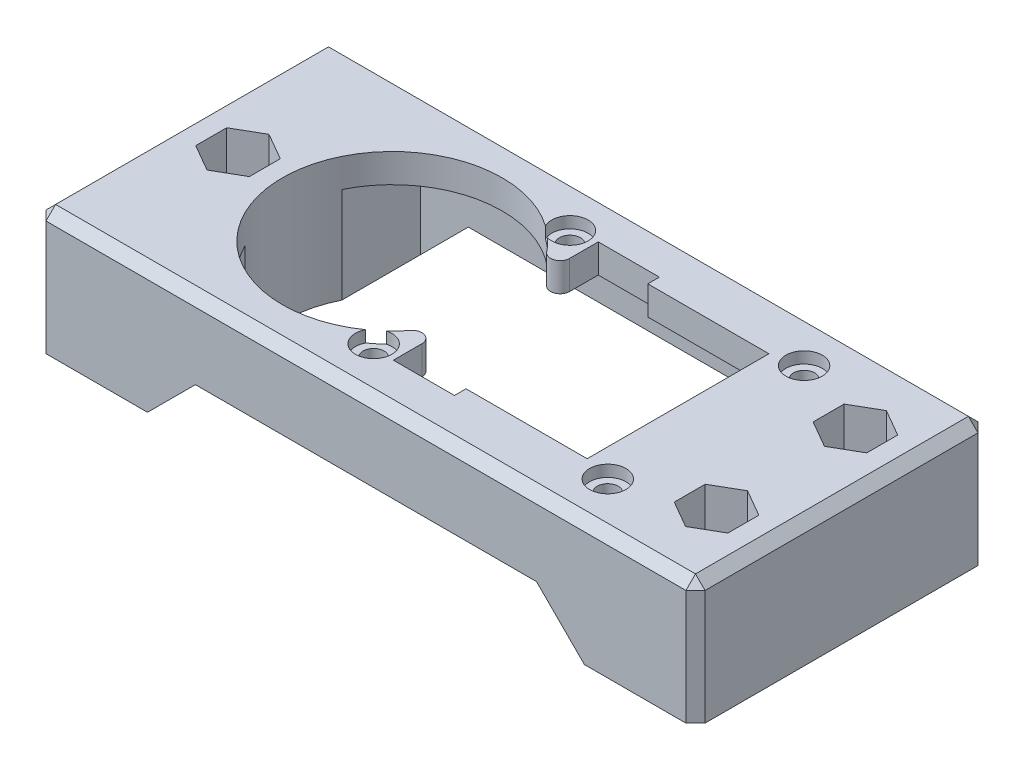
from build123d import *

# Parameters (mm, degrees)
ESQUISSE1_W                                        = 50.5
ESQUISSE1_H                                        = 26.5
ESQUISSE1_R                                        = 1.1
BOSS_EXTRU_1_DEPTH                                 = 3
CONG_1_R                                           = 1
CHAMBRAGE_POUR_VIS_SIX_PANS_CREUX_M1_6_D           = 2.2
CHAMBRAGE_POUR_VIS_SIX_PANS_CREUX_M1_6_CBORE_D     = 3.8
CHAMBRAGE_POUR_VIS_SIX_PANS_CREUX_M1_6_CBORE_DEPTH = 1.2
BOSS_EXTRU_2_START                                 = -19
ESQUISSE4_R                                        = 1.6
ESQUISSE4_W                                        = 11.6
ESQUISSE4_H                                        = 26.5
BOSS_EXTRU_2_DEPTH                                 = 19
ENL_V_START                                        = -19
ENL_V_MAT_EXTRU_1_DEPTH                            = 7
ESQUISSE6_W                                        = 11.6
ESQUISSE6_H                                        = 6
ENL_V_MAT_EXTRU_2_DEPTH                            = 50.487191272
BOSS_EXTRU_3_DEPTH                                 = 2
CHANFREIN1_SIZE                                    = 1


with BuildPart() as part:
    # Esquisse1 → Boss.-Extru.1 (new body)
    with BuildSketch(Plane(origin=(0, 0, 0), x_dir=(1, 0, 0), z_dir=(0, 1, 0))):
        with Locations((4.2, 10.25)):
            Rectangle(ESQUISSE1_W, ESQUISSE1_H)
        with Locations(Location((0, 0, 0), (0, 0, 270))):
            Circle(ESQUISSE1_R, mode=Mode.SUBTRACT)
        with Locations(Location((24.45, 0, 0), (0, 0, 270))):
            Circle(ESQUISSE1_R, mode=Mode.SUBTRACT)
        with BuildLine():
            Line((8.89, 20.95), (8.89, 19.74))
            Line((8.89, 19.74), (21.54, 19.74))
            Line((21.54, 19.74), (21.54, 0.76))
            Line((21.54, 0.76), (8.89, 0.76))
            Line((8.89, 0.76), (8.89, -0.45))
            Line((8.89, -0.45), (2.51, -0.45))
            Line((2.51, -0.45), (2.51, 6.385507795))
            ThreePointArc((2.51, 6.385507795), (-19.78, 10.25), (2.51, 14.114492205))
            Line((2.51, 14.114492205), (2.51, 20.95))
            Line((2.51, 20.95), (8.89, 20.95))
        make_face(mode=Mode.SUBTRACT)
        with Locations(Location((0, 20.5, 0), (0, 0, 270))):
            Circle(ESQUISSE1_R, mode=Mode.SUBTRACT)
        with Locations(Location((24.45, 20.5, 0), (0, 0, 270))):
            Circle(ESQUISSE1_R, mode=Mode.SUBTRACT)
    extrude(amount=BOSS_EXTRU_1_DEPTH)

    # Congé1
    cong_1_edges = [part.edges().sort_by_distance(p)[0] for p in [
        (2.51, 1.5, -6.385507795),
        (2.51, 1.5, -14.114492205),
    ]]
    fillet(cong_1_edges, radius=CONG_1_R)

    # Chambrage pour vis à six pans creux M1.61 (through all)
    with Locations(Plane(origin=(0, 3, 0), x_dir=(1, 0, 0), z_dir=(0, 1, 0))):
        with Locations((0, 0), (0, 20.5), (24.45, 20.5), (24.45, 0)):
            CounterBoreHole(CHAMBRAGE_POUR_VIS_SIX_PANS_CREUX_M1_6_D / 2, CHAMBRAGE_POUR_VIS_SIX_PANS_CREUX_M1_6_CBORE_D / 2, CHAMBRAGE_POUR_VIS_SIX_PANS_CREUX_M1_6_CBORE_DEPTH)

    # Esquisse4 → Boss.-Extru.2 (add)
    # profile 1 of 2: a face of its own
    with BuildSketch(Plane(origin=(0, 3, 0), x_dir=(1, 0, 0), z_dir=(0, 1, 0)).offset(BOSS_EXTRU_2_START)):
        with BuildLine():
            Line((-18.61, 23.5), (-30.21, 23.5))
            Line((-30.21, 23.5), (-30.21, -3))
            Line((-30.21, -3), (-18.61, -3))
            Line((-18.61, -3), (-18.61, 5.200811946))
            ThreePointArc((-18.61, 5.200811946), (-19.78, 10.25), (-18.61, 15.299188054))
            Line((-18.61, 15.299188054), (-18.61, 23.5))
        make_face()
        with Locations(Location((-24.41, 10.25, 0), (0, 0, 270))):
            Circle(ESQUISSE4_R, mode=Mode.SUBTRACT)
    # profile 2 of 2: a face of its own
    with BuildSketch(Plane(origin=(0, 3, 0), x_dir=(1, 0, 0), z_dir=(0, 1, 0)).offset(BOSS_EXTRU_2_START)):
        with Locations((32.81, 10.25)):
            Rectangle(ESQUISSE4_W, ESQUISSE4_H)
        with Locations(Location((32.81, 3, 0), (0, 0, 90))):
            Circle(ESQUISSE4_R, mode=Mode.SUBTRACT)
        with Locations(Location((32.81, 17.5, 0), (0, 0, 90))):
            Circle(ESQUISSE4_R, mode=Mode.SUBTRACT)
    extrude(amount=BOSS_EXTRU_2_DEPTH)

    # Esquisse5 → Enlèv. mat.-Extru.1 (cut)
    with BuildSketch(Plane.XZ.offset(16).offset(ENL_V_START)):
        Polygon((-24.41, -7.016838493), (-27.21, -8.633419246), (-27.21, -11.866580754), (-24.41, -13.483161507), (-21.61, -11.866580754), (-21.61, -8.633419246), align=None)
        Polygon((32.81, -14.266838493), (30.01, -15.883419246), (30.01, -19.116580754), (32.81, -20.733161507), (35.61, -19.116580754), (35.61, -15.883419246), align=None)
        Polygon((32.81, 0.233161507), (30.01, -1.383419246), (30.01, -4.616580754), (32.81, -6.233161507), (35.61, -4.616580754), (35.61, -1.383419246), align=None)
    extrude(amount=ENL_V_MAT_EXTRU_1_DEPTH, mode=Mode.SUBTRACT)

    # Esquisse6 → Enlèv. mat.-Extru.2 (cut, through all)
    with BuildSketch(Plane(origin=(0, 0, -23.5), x_dir=(-1, 0, 0), z_dir=(0, 0, -1))):
        with Locations((-32.81, -13)):
            Rectangle(ESQUISSE6_W, ESQUISSE6_H)
        with Locations((24.41, -13)):
            Rectangle(ESQUISSE6_W, ESQUISSE6_H)
    extrude(amount=-ENL_V_MAT_EXTRU_2_DEPTH, mode=Mode.SUBTRACT)

    # Esquisse7 → Boss.-Extru.3 (add)
    with BuildSketch(Plane(origin=(0, 0, -23.5), x_dir=(-1, 0, 0), z_dir=(0, 0, -1))):
        Polygon((8.61, 0), (-4.2, 0), (-17.01, 0), (-22.01, -5), (13.61, -5), align=None)
        Polygon((-22.01, -5), (-17.01, 0), (-27.01, 0), (-27.01, -10), align=None)
        Polygon((-17.01, 0), (-4.2, 0), (-4.2, 3), (-38.61, 3), (-38.61, -10), (-27.01, -10), (-27.01, 0), align=None)
        Polygon((18.61, 0), (8.61, 0), (13.61, -5), (18.61, -10), align=None)
        Polygon((-4.2, 3), (-4.2, 0), (8.61, 0), (18.61, 0), (18.61, -10), (30.21, -10), (30.21, 3), align=None)
    boss_extru_3 = extrude(amount=BOSS_EXTRU_3_DEPTH)

    # Symétrie1: Boss.-Extru.3 across plane
    add(boss_extru_3.mirror(Plane(origin=(0, 0, -10.25), x_dir=(1, 0, 0), z_dir=(0, 0, -1))))

    # Chanfrein1
    chanfrein1_edges = [part.edges().sort_by_distance(p)[0] for p in [
        (-30.21, 3, -10.25),
        (38.61, 3, -10.25),
        (-30.21, -3.5, -25.5),
        (4.2, 3, -25.5),
        (38.61, -3.5, -25.5),
        (38.61, -3.5, 5),
        (4.2, 3, 5),
        (-30.21, -3.5, 5),
    ]]
    chamfer(chanfrein1_edges, length=CHANFREIN1_SIZE)


solid = part.part
